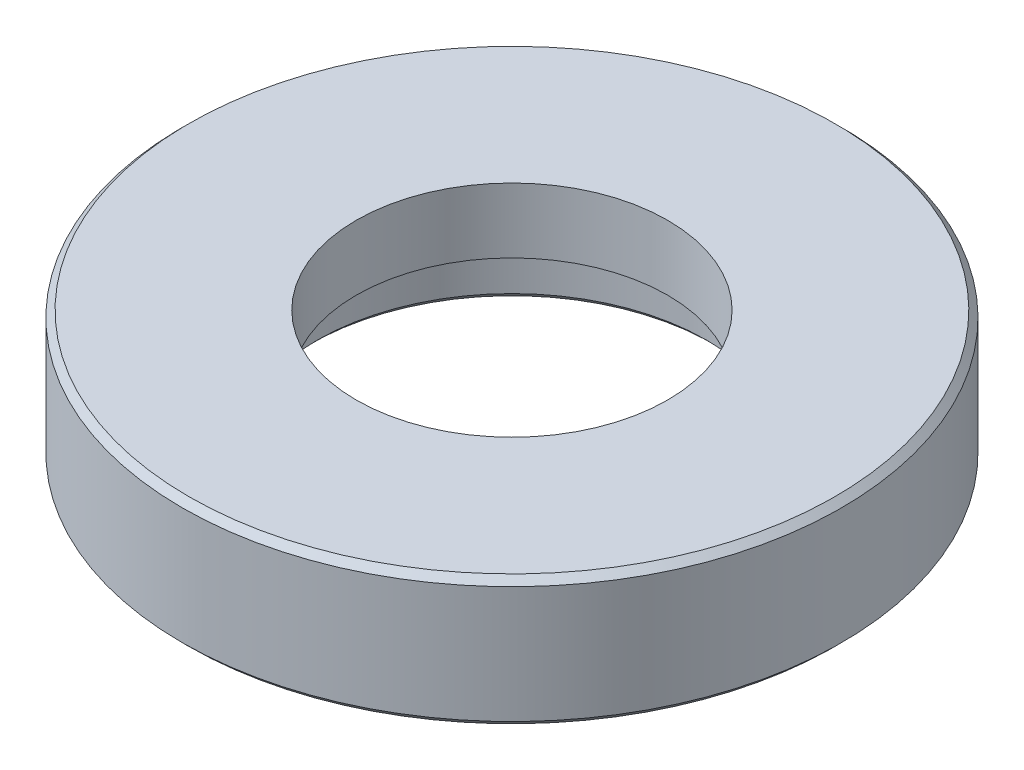
from build123d import *

# Parameters (mm, degrees)
SKETCH1_R           = 12.7
BOSS_EXTRUDE1_DEPTH = 5
SKETCH1_3_R         = 6
CUT_EXTRUDE1_DEPTH  = 5
SKETCH1_4_R         = 7.5
SKETCH1_4_R_2       = 6
CUT_EXTRUDE2_DEPTH  = 2.5
CHAMFER1_SIZE       = 0.25


with BuildPart() as part:
    # Sketch1 → Boss-Extrude1 (new body)
    with BuildSketch(Plane(origin=(0, 0, 0), x_dir=(1, 0, 0), z_dir=(0, 1, 0))):
        with Locations(Location((0, 0, 0), (0, 0, 270))):
            Circle(SKETCH1_R)
    extrude(amount=BOSS_EXTRUDE1_DEPTH)

    # Sketch1<3> → Cut-Extrude1 (cut)
    with BuildSketch(Plane(origin=(0, 0, 0), x_dir=(1, 0, 0), z_dir=(0, 1, 0))):
        with Locations(Location((0, 0, 0), (0, 0, 270))):
            Circle(SKETCH1_3_R)
    extrude(amount=CUT_EXTRUDE1_DEPTH, mode=Mode.SUBTRACT)

    # Sketch1<4> → Cut-Extrude2 (cut)
    with BuildSketch(Plane(origin=(0, 0, 0), x_dir=(1, 0, 0), z_dir=(0, 1, 0))):
        with Locations(Location((0, 0, 0), (0, 0, 270))):
            Circle(SKETCH1_4_R)
        with Locations(Location((0, 0, 0), (0, 0, 270))):
            Circle(SKETCH1_4_R_2, mode=Mode.SUBTRACT)
    extrude(amount=CUT_EXTRUDE2_DEPTH, mode=Mode.SUBTRACT)

    # Chamfer1
    chamfer1_edges = [part.edges().sort_by_distance(p)[0] for p in [
        (0, 0, -7.5),
        (0, 0, -12.7),
        (0, 5, -12.7),
    ]]
    chamfer(chamfer1_edges, length=CHAMFER1_SIZE)


solid = part.part
